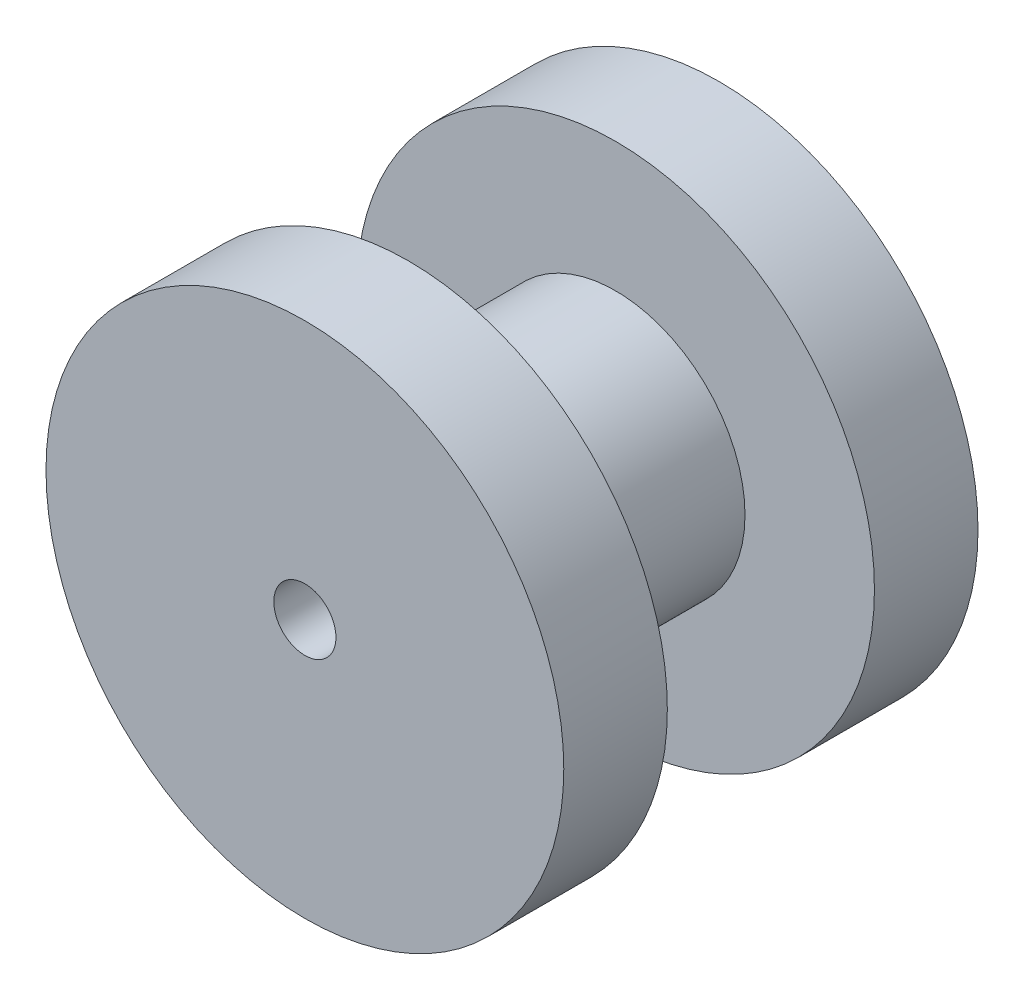
from build123d import *

# Parameters (mm, degrees)
SKETCH1_R           = 50
BOSS_EXTRUDE1_DEPTH = 20
SKETCH2_R           = 25
BOSS_EXTRUDE2_DEPTH = 40
BOSS_EXTRUDE3_START = 20
SKETCH3_R           = 50
BOSS_EXTRUDE3_DEPTH = 20
SKETCH4_R           = 6
CUT_EXTRUDE1_DEPTH  = 107.77078252


with BuildPart() as part:
    # Sketch1 → Boss-Extrude1 (new body)
    with BuildSketch(Plane.XY):
        Circle(SKETCH1_R)
    extrude(amount=BOSS_EXTRUDE1_DEPTH)

    # Sketch2 → Boss-Extrude2 (add)
    with BuildSketch(Plane(origin=(0, 0, 0), x_dir=(-1, 0, 0), z_dir=(0, 0, -1))):
        Circle(SKETCH2_R)
    extrude(amount=BOSS_EXTRUDE2_DEPTH)

    # Sketch3 → Boss-Extrude3 (add)
    with BuildSketch(Plane(origin=(0, 0, -40), x_dir=(-1, 0, 0), z_dir=(0, 0, -1)).offset(BOSS_EXTRUDE3_START)):
        with Locations(Location((0, 0, 0), (0, 0, 180))):
            Circle(SKETCH3_R)
    extrude(amount=-BOSS_EXTRUDE3_DEPTH)

    # Sketch4 → Cut-Extrude1 (cut, through all)
    with BuildSketch(Plane.XY.offset(20)):
        Circle(SKETCH4_R)
    extrude(amount=-CUT_EXTRUDE1_DEPTH, mode=Mode.SUBTRACT)


solid = part.part
